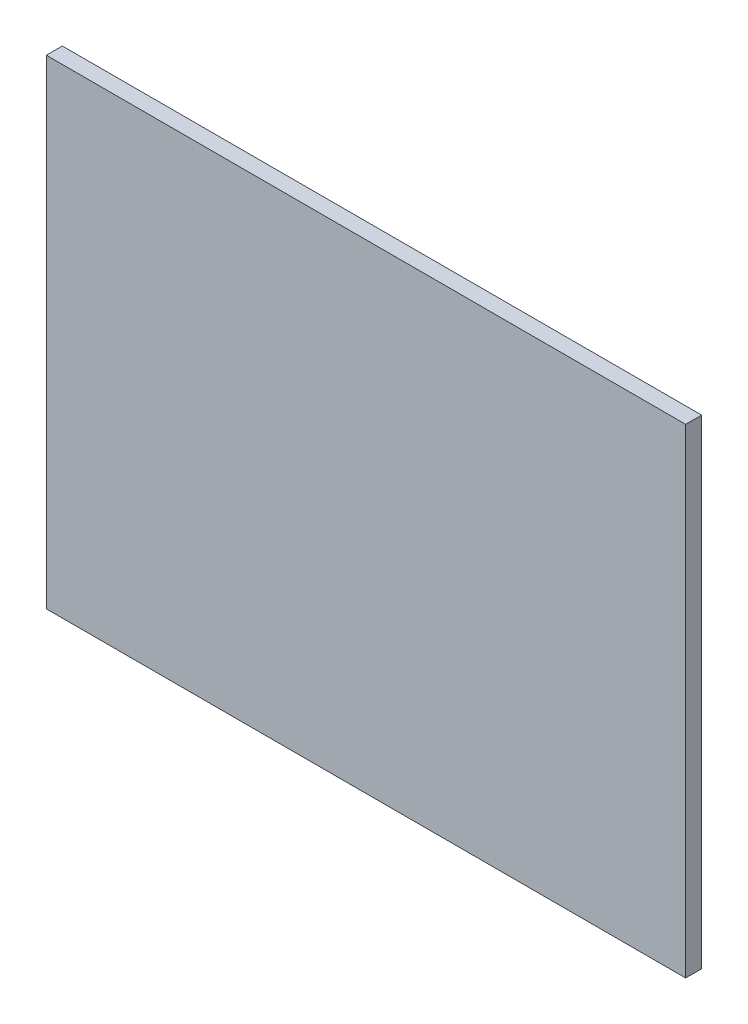
from build123d import *

# Parameters (mm, degrees)
SKETCH1_W           = 60
SKETCH1_H           = 80
BOSS_EXTRUDE1_DEPTH = 2
SCALE1_SCALE        = 0.7


with BuildPart() as part:
    # Sketch1 → Boss-Extrude1 (new body)
    with BuildSketch(Plane(origin=(0, 0, 0), x_dir=(0, 1, 0), z_dir=(0, 0, 1))):
        Rectangle(SKETCH1_W, SKETCH1_H)
    extrude(amount=-BOSS_EXTRUDE1_DEPTH)


with BuildPart() as part_1:
    # Scale1: scaled about (0, 0, -1)
    add(part.part.scale(SCALE1_SCALE).moved(Location((0, 0, -0.3))))


solid = part_1.part
